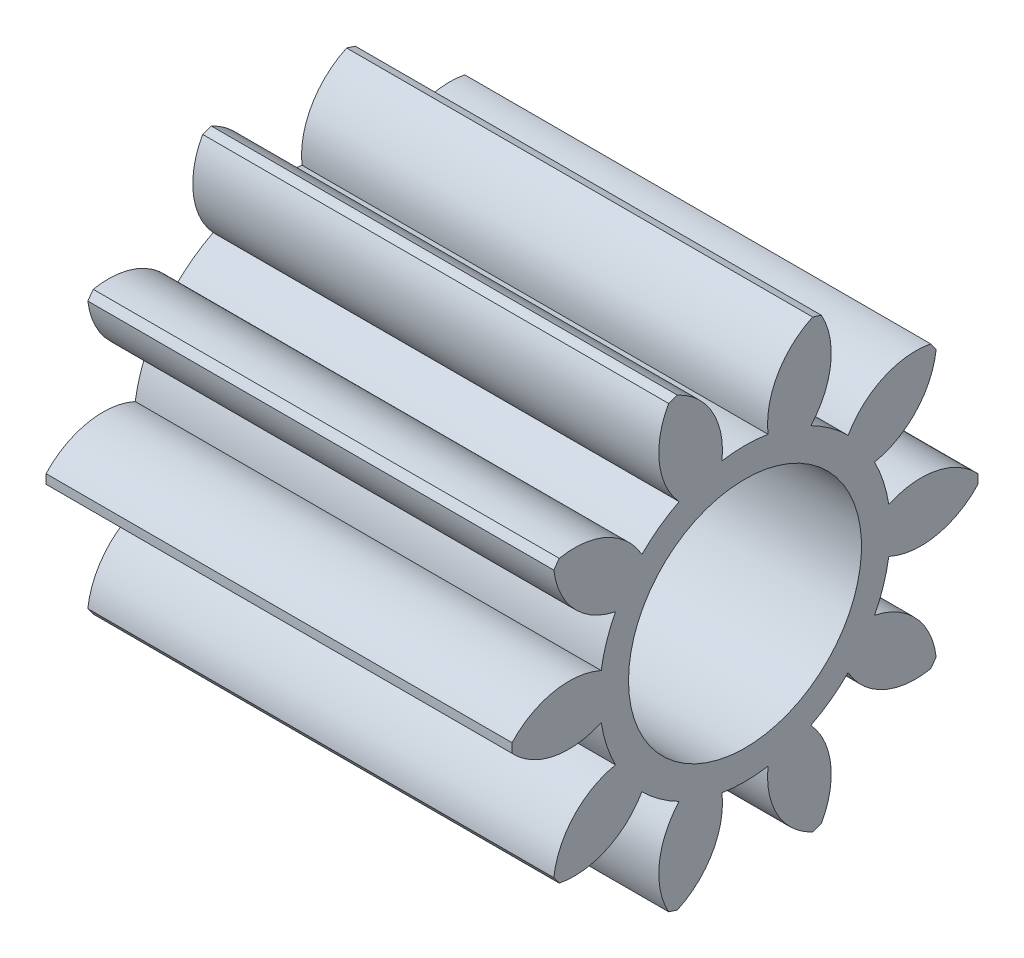
from build123d import *

# Parameters (mm, degrees)
BASPROSKE_W     = 6
BASPROSKE_H     = 3
TOOTHCUT_DEPTH  = 8.348469228
TEETHCUTS_COUNT = 10
BORSKE_R        = 1.5
BORE_DEPTH      = 50.0000508


with BuildPart() as part:
    # BasProSke → Base-Revolve (revolve)
    with BuildSketch(Plane(origin=(0, 0, 0), x_dir=(1, 0, 0), z_dir=(0, 1, 0)), mode=Mode.PRIVATE) as base_revolve_sk:
        with Locations((3, 1.5)):
            Rectangle(BASPROSKE_W, BASPROSKE_H)
    revolve(base_revolve_sk.sketch.rotate(Axis((-10, 0, 0), (1, 0, 0)), 180), axis=Axis((-10, 0, 0), (1, 0, 0)))

    # TooCutSke → ToothCut (cut, through all)
    with BuildSketch(Plane(origin=(0, 0, 0), x_dir=(0, 0, -1), z_dir=(1, 0, 0))):
        with BuildLine():
            ThreePointArc((0.296449938, 1.850403587), (0, 1.874), (-0.296449938, 1.850403587))
            ThreePointArc((-0.296449938, 1.850403587), (-0.428089565, 2.470295585), (-0.905889751, 2.886591228))
            ThreePointArc((-0.905889751, 2.886591228), (0, 3.0254), (0.905889751, 2.886591228))
            ThreePointArc((0.905889751, 2.886591228), (0.428089565, 2.470295585), (0.296449938, 1.850403587))
        make_face()
    toothcut = extrude(amount=TOOTHCUT_DEPTH, mode=Mode.SUBTRACT)

    # TeethCuts: ToothCut ×10 about axis
    teethcuts_axis = Axis((0, 0, 0), (1, 0, 0))
    for i in range(1, TEETHCUTS_COUNT):
        add(toothcut.rotate(teethcuts_axis, i * 360 / TEETHCUTS_COUNT), mode=Mode.SUBTRACT)

    # BorSke → Bore (cut, symmetric)
    with BuildSketch(Plane(origin=(0, 0, 0), x_dir=(0, 0, -1), z_dir=(1, 0, 0))):
        with Locations(Location((0, 0, 0), (0, 0, 180))):
            Circle(BORSKE_R)
    extrude(amount=BORE_DEPTH, both=True, mode=Mode.SUBTRACT)


solid = part.part
